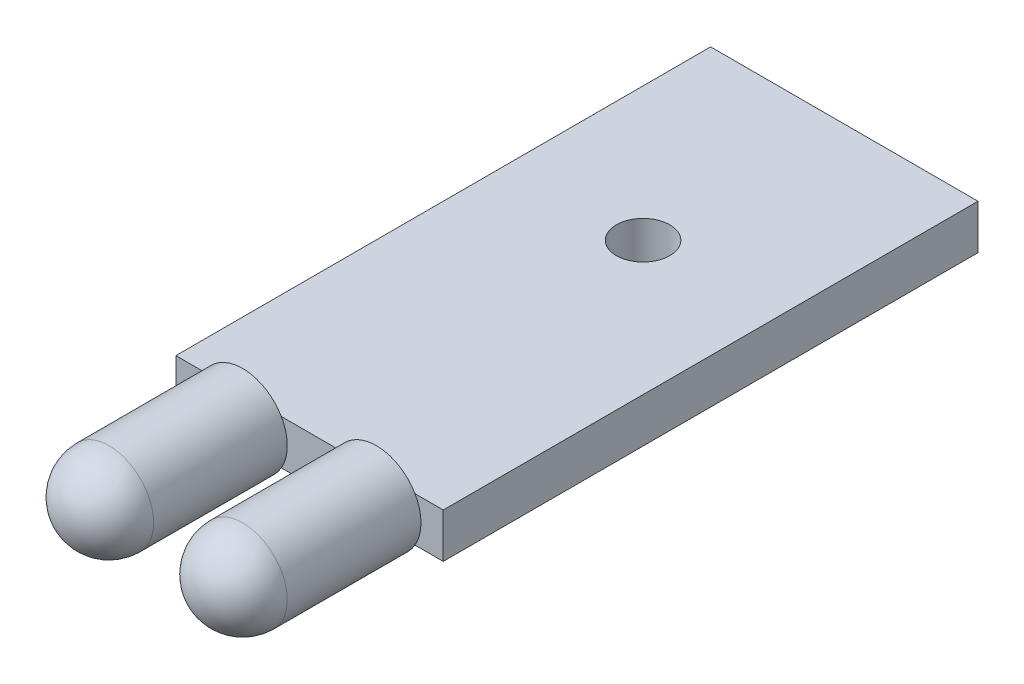
from build123d import *

# Parameters (mm, degrees)
SKETCH2_W                 = 15
SKETCH2_H                 = 30
BOSS_EXTRUDE1_DEPTH       = 2.5
SKETCH3_R                 = 2.5
BOSS_EXTRUDE2_DEPTH       = 10
FILLET3_R                 = 2.5
FILLET4_R                 = 2.5
F_3_0MM_DOWEL_HOLE1_D     = 3
F_3_0MM_DOWEL_HOLE1_DEPTH = 12
F_3_0MM_DOWEL_HOLE1_TIP   = 0.901290929


with BuildPart() as part:
    # Sketch2 → Boss-Extrude1 (new body)
    with BuildSketch(Plane(origin=(0, 0, 0), x_dir=(1, 0, 0), z_dir=(0, 1, 0))):
        with Locations((-7.5, 15)):
            Rectangle(SKETCH2_W, SKETCH2_H)
    extrude(amount=BOSS_EXTRUDE1_DEPTH)

    # Sketch3 → Boss-Extrude2 (add)
    with BuildSketch(Plane.XY):
        with BuildLine():
            ThreePointArc((-13.75, 1.25), (-11.25, -1.25), (-8.75, 1.25))
            Line((-8.75, 1.25), (-13.75, 1.25))
        make_face()
        with BuildLine():
            Line((-13.75, 1.25), (-8.75, 1.25))
            ThreePointArc((-8.75, 1.25), (-11.25, 3.75), (-13.75, 1.25))
        make_face()
        with Locations(Location((-3.75, 1.25, 0), (0, 0, 150))):
            Circle(SKETCH3_R)
    extrude(amount=BOSS_EXTRUDE2_DEPTH)

    # Fillet3
    fillet3_edges = [part.edges().sort_by_distance(p)[0] for p in [
        (-13.75, 1.25, 10),
    ]]
    fillet(fillet3_edges, radius=FILLET3_R)

    # Fillet4
    fillet4_edges = [part.edges().sort_by_distance(p)[0] for p in [
        (-1.584936491, 0, 10),
    ]]
    fillet(fillet4_edges, radius=FILLET4_R)

    # Ø3.0mm Dowel Hole1
    with Locations(Plane(origin=(0, 2.5, 0), x_dir=(1, 0, 0), z_dir=(0, 1, 0))):
        with Locations((-7.5, 18.71)):
            Hole(F_3_0MM_DOWEL_HOLE1_D / 2, depth=F_3_0MM_DOWEL_HOLE1_DEPTH)
            with Locations((0, 0, -(F_3_0MM_DOWEL_HOLE1_DEPTH + F_3_0MM_DOWEL_HOLE1_TIP / 2))):  # 118° drill point
                Cone(0, F_3_0MM_DOWEL_HOLE1_D / 2, F_3_0MM_DOWEL_HOLE1_TIP, mode=Mode.SUBTRACT)


solid = part.part
